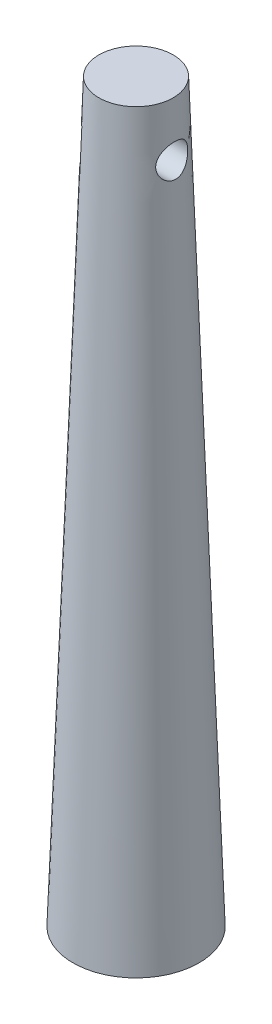
from build123d import *

# Parameters (mm, degrees)
CUT_EXTRUDE1_DEPTH      = 71.66729416
CUT_EXTRUDE1_DEPTH_BACK = 71.66729416
SKETCH2_R               = 1.524


with BuildPart() as part:
    # Sketch1 → Revolve1 (revolve)
    with BuildSketch(Plane.XY, mode=Mode.PRIVATE) as revolve1_sk:
        Polygon((0, 0), (0, 70.1548), (3.5433, 70.1548), (6.0071, 0), align=None)
    revolve(revolve1_sk.sketch.rotate(Axis((0, 0, 0), (0, 1, 0)), 90), axis=Axis((0, 0, 0), (0, 1, 0)))

    # Sketch2 → Cut-Extrude1 (cut, two sides: drawn at the far end of the back side and taken through both)
    with BuildSketch(Plane(origin=(0, 0, 0), x_dir=(0, 0, -1), z_dir=(1, 0, 0)).offset(-CUT_EXTRUDE1_DEPTH_BACK)):
        with Locations(Location((0, 65.0748, 0), (0, 0, 314.094407866))):
            Circle(SKETCH2_R)
    extrude(amount=CUT_EXTRUDE1_DEPTH + CUT_EXTRUDE1_DEPTH_BACK, mode=Mode.SUBTRACT)


solid = part.part
